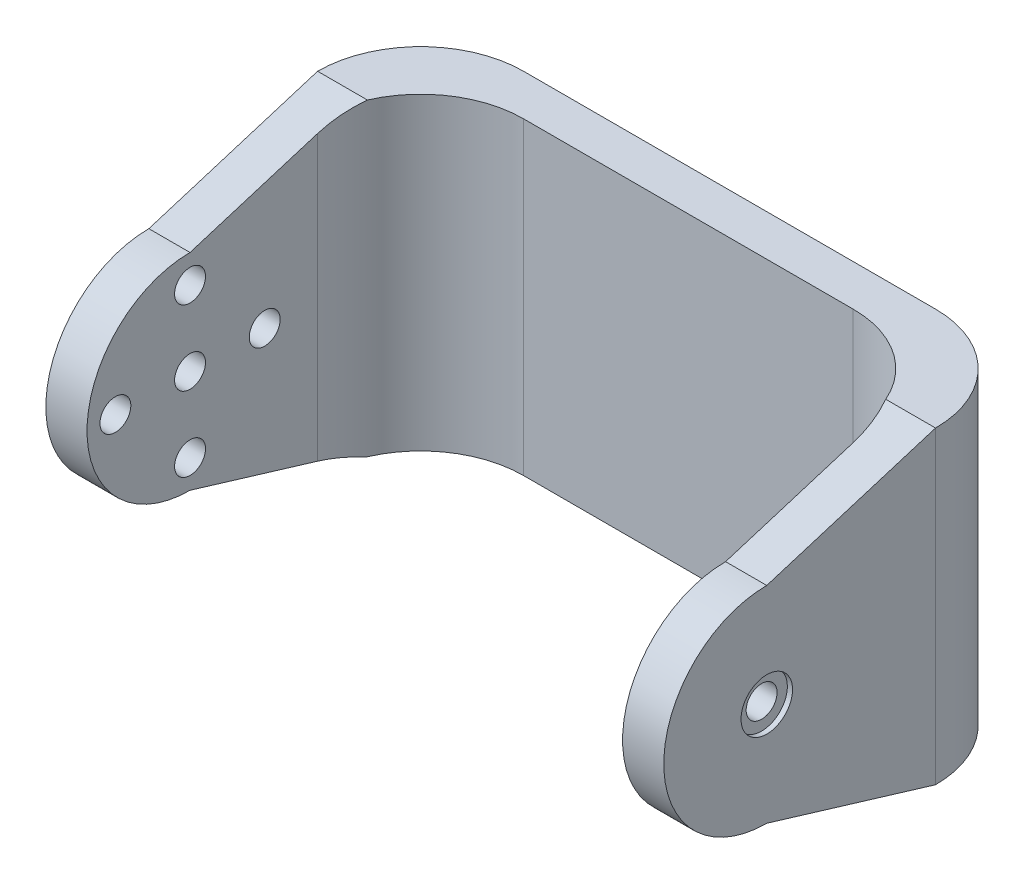
from build123d import *

# Parameters (mm, degrees)
EXTRUDE_1_DEPTH     = 30
FILLET_1_R          = 10
FILLET_2_R          = 10
SKETCH_4_R          = 1.5
CUT_EXTRUDE_1_DEPTH = 4
CUT_EXTRUDE_2_DEPTH = 71.641899783
CUT_EXTRUDE_START   = -4
SKETCH_6_R          = 1.5
CUT_EXTRUDE_3_DEPTH = 4
SKETCH_7_R          = 2.5
CUT_EXTRUDE_4_DEPTH = 0.5


with BuildPart() as part:
    # 草图2 → 凸台-拉伸1 (new body)
    with BuildSketch(Plane(origin=(0, 0, 0), x_dir=(1, 0, 0), z_dir=(0, 1, 0))):
        Polygon((23.688888889, -16.857777778), (23.688888889, 18.142222222), (-28.311111111, 18.142222222), (-28.311111111, -16.857777778), (-32.311111111, -16.857777778), (-32.311111111, 22.142222222), (27.688888889, 22.142222222), (27.688888889, -16.857777778), align=None)
    extrude(amount=EXTRUDE_1_DEPTH)

    # 圆角1
    fillet_1_edges = [part.edges().sort_by_distance(p)[0] for p in [
        (23.688888889, 15, -18.142222222),
        (27.688888889, 15, -22.142222222),
    ]]
    fillet(fillet_1_edges, radius=FILLET_1_R)

    # 圆角2
    fillet_2_edges = [part.edges().sort_by_distance(p)[0] for p in [
        (-28.311111111, 15, -18.142222222),
        (-32.311111111, 15, -22.142222222),
    ]]
    fillet(fillet_2_edges, radius=FILLET_2_R)

    # 草图4 → 切除-拉伸1 (cut)
    with BuildSketch(Plane.ZY.offset(32.311111111)):
        with Locations((-3.006286177, 14.956055529)):
            Circle(SKETCH_4_R)
        with Locations((11.493713823, 14.954055529)):
            Circle(SKETCH_4_R)
        with Locations((4.244713823, 22.205055529)):
            Circle(SKETCH_4_R)
        with Locations((4.242713823, 7.705055529)):
            Circle(SKETCH_4_R)
        with Locations((4.244713823, 14.955055529)):
            Circle(SKETCH_4_R)
    extrude(amount=-CUT_EXTRUDE_1_DEPTH, mode=Mode.SUBTRACT)

    # 草图5 → 切除-拉伸2 (cut, through all)
    with BuildSketch(Plane.ZY.offset(32.311111111)):
        with BuildLine():
            Line((16.857777778, 0), (4.244713823, 0))
            Line((4.244713823, 0), (-12.142222222, 0))
            Line((-12.142222222, 0), (4.244713823, 4.955055529))
            ThreePointArc((4.244713823, 4.955055529), (14.244713823, 14.955055529), (4.244713823, 24.955055529))
            Line((4.244713823, 24.955055529), (-12.142222222, 30))
            Line((-12.142222222, 30), (4.244713823, 30))
            Line((4.244713823, 30), (16.857777778, 30))
            Line((16.857777778, 30), (16.857777778, 0))
        make_face()
    extrude(amount=-CUT_EXTRUDE_2_DEPTH, mode=Mode.SUBTRACT)

    # 草图6 → 切除-拉伸3 (cut)
    with BuildSketch(Plane(origin=(27.688888889, 0, 0), x_dir=(0, 0, -1), z_dir=(1, 0, 0)).offset(CUT_EXTRUDE_START)):
        with Locations(Location((-4.244713823, 14.955055529, 0), (0, 0, 180))):
            Circle(SKETCH_6_R)
    extrude(amount=CUT_EXTRUDE_3_DEPTH, mode=Mode.SUBTRACT)

    # 草图7 → 切除-拉伸4 (cut)
    with BuildSketch(Plane(origin=(27.688888889, 0, 0), x_dir=(0, 0, -1), z_dir=(1, 0, 0))):
        with Locations((-4.244713823, 14.955055529)):
            Circle(SKETCH_7_R)
    extrude(amount=-CUT_EXTRUDE_4_DEPTH, mode=Mode.SUBTRACT)


solid = part.part
